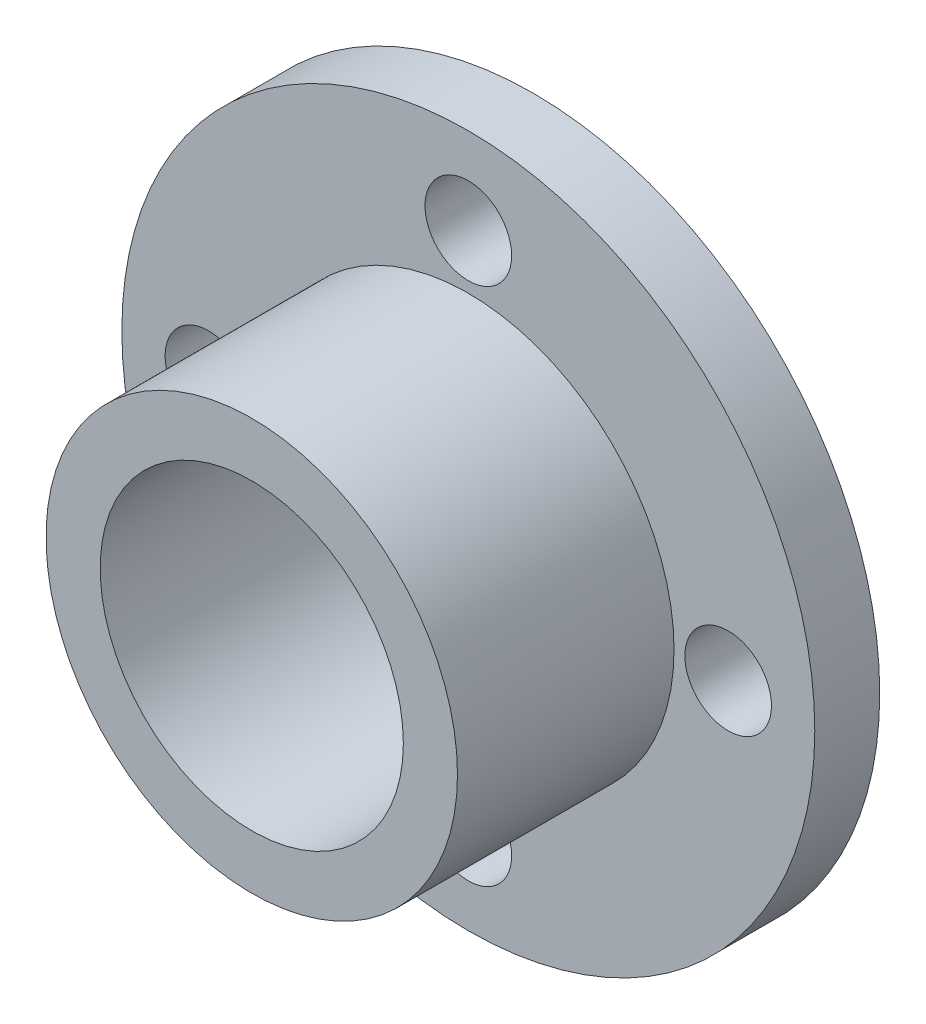
from build123d import *

# Parameters (mm, degrees)
SKETCH_1_R          = 16
SKETCH_1_R_2        = 7
EXTRUDE_1_DEPTH     = 3
SKETCH_2_R          = 9.5
SKETCH_2_R_2        = 7
EXTRUDE_2_DEPTH     = 10
SKETCH_3_R          = 2
CUT_EXTRUDE_1_DEPTH = 10


with BuildPart() as part:
    # 草图1 → 凸台-拉伸1 (new body)
    with BuildSketch(Plane.XY):
        Circle(SKETCH_1_R)
        Circle(SKETCH_1_R_2, mode=Mode.SUBTRACT)
    extrude(amount=EXTRUDE_1_DEPTH)

    # 草图2 → 凸台-拉伸2 (add)
    with BuildSketch(Plane.XY.offset(3)):
        Circle(SKETCH_2_R)
        Circle(SKETCH_2_R_2, mode=Mode.SUBTRACT)
    extrude(amount=EXTRUDE_2_DEPTH)

    # 草图3 → 切除-拉伸1 (cut)
    with BuildSketch(Plane.XY.offset(3)):
        with Locations((0, -12)):
            Circle(SKETCH_3_R)
        with Locations((-12, 0)):
            Circle(SKETCH_3_R)
        with Locations((0, 12)):
            Circle(SKETCH_3_R)
        with Locations((12, 0)):
            Circle(SKETCH_3_R)
    extrude(amount=-CUT_EXTRUDE_1_DEPTH, mode=Mode.SUBTRACT)


solid = part.part
